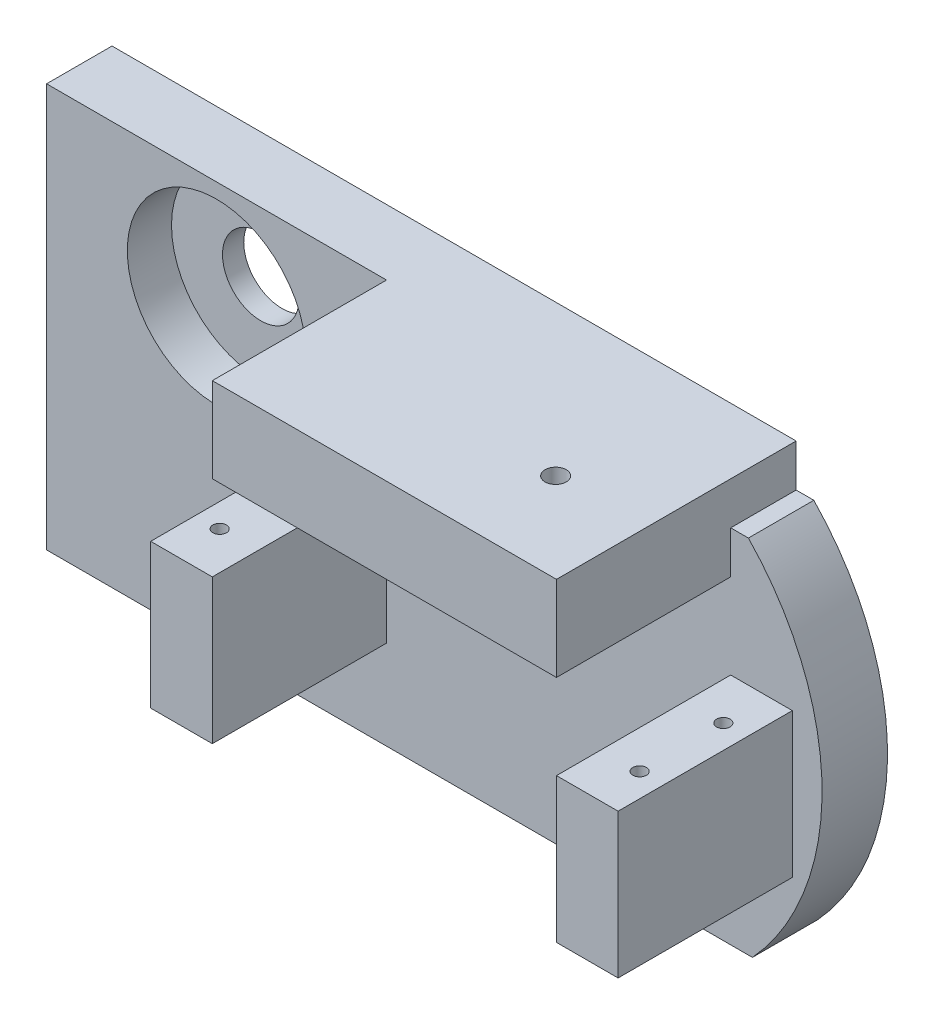
from build123d import *

# Parameters (mm, degrees)
ESQUISSE1_W              = 55
ESQUISSE1_H              = 43
BOSS_EXTRU_1_DEPTH       = 27
ESQUISSE2_W              = 40.5
ESQUISSE2_H              = 21.676575317
ENL_V_MAT_EXTRU_1_DEPTH  = 38
ESQUISSE3_R              = 0.7
ENL_V_MAT_EXTRU_2_DEPTH  = 43
ESQUISSE4_W              = 55
ESQUISSE4_H              = 20.5
ENL_V_MAT_EXTRU_3_DEPTH  = 11
ENL_V_MAT_EXTRU_6_REACH  = 66.933
ESQUISSE5_W              = 20.5
ESQUISSE5_H              = 10
ESQUISSE6_W              = 7.25
ESQUISSE6_H              = 20.5
ENL_V_MAT_EXTRU_7_DEPTH  = 5
ESQUISSE7_R              = 31
BOSS_EXTRU_2_DEPTH       = 6.5
ESQUISSE8_R              = 41
ESQUISSE8_R_2            = 31
ENL_V_MAT_EXTRU_8_DEPTH  = 6.5
TROU_TARAUD_M2X0_41_D    = 1.6
ESQUISSE10_R             = 10.5
ENL_V_MAT_EXTRU_9_DEPTH  = 4.5
ESQUISSE11_R             = 4.5
ENL_V_MAT_EXTRU_10_DEPTH = 2
ESQUISSE12_R             = 9.25
ESQUISSE12_R_2           = 1.25
BOSS_EXTRU_3_DEPTH       = 5
ESQUISSE13_W             = 50.114904395
ESQUISSE13_H             = 12.012600019
ENL_V_MAT_EXTRU_11_DEPTH = 6.5
BOSS_EXTRU_4_START       = 1.2
BOSS_EXTRU_4_DEPTH       = 1.2
ESQUISSE15_W             = 53.005482756
ESQUISSE15_H             = 10
ENL_V_MAT_EXTRU_12_DEPTH = 7.7
ESQUISSE16_R             = 4.5
ENL_V_MAT_EXTRU_13_DEPTH = 1.2
BOSS_EXTRU_5_START       = -28.2
ESQUISSE17_W             = 40.5
ESQUISSE17_H             = 5
BOSS_EXTRU_5_DEPTH       = 28.2
ESQUISSE18_R             = 1
ENL_V_MAT_EXTRU_14_DEPTH = 10
TROU_TARAUD_M3X0_51_D    = 2.5
ESQUISSE22_R             = 4.5
BOSS_EXTRU_6_DEPTH       = 7.7
ESQUISSE23_R             = 10.5
ENL_V_MAT_EXTRU_15_DEPTH = 5.2
ESQUISSE24_R             = 12.885190895
BOSS_EXTRU_7_DEPTH       = 7.7


with BuildPart() as part:
    # Esquisse1 → Boss.-Extru.1 (new body)
    with BuildSketch(Plane.XY):
        Rectangle(ESQUISSE1_W, ESQUISSE1_H)
    extrude(amount=BOSS_EXTRU_1_DEPTH)

    # Esquisse2 → Enlèv. mat.-Extru.1 (cut)
    with BuildSketch(Plane.XZ.offset(21.5)):
        with Locations((0, 17.338287659)):
            Rectangle(ESQUISSE2_W, ESQUISSE2_H)
    extrude(amount=-ENL_V_MAT_EXTRU_1_DEPTH, mode=Mode.SUBTRACT)

    # Esquisse3 → Enlèv. mat.-Extru.2 (cut)
    with BuildSketch(Plane.XZ.offset(21.5)):
        with Locations(Location((-24.71, 21.675, 0), (0, 0, 270))):
            Circle(ESQUISSE3_R)
        with Locations(Location((-24.71, 11.825, 0), (0, 0, 270))):
            Circle(ESQUISSE3_R)
        with Locations(Location((24.71, 11.825, 0), (0, 0, 270))):
            Circle(ESQUISSE3_R)
        with Locations(Location((24.71, 21.675, 0), (0, 0, 270))):
            Circle(ESQUISSE3_R)
    extrude(amount=-ENL_V_MAT_EXTRU_2_DEPTH, mode=Mode.SUBTRACT)

    # Esquisse4 → Enlèv. mat.-Extru.3 (cut)
    with BuildSketch(Plane.XZ.offset(21.5)):
        with Locations((0, 16.75)):
            Rectangle(ESQUISSE4_W, ESQUISSE4_H)
    extrude(amount=-ENL_V_MAT_EXTRU_3_DEPTH, mode=Mode.SUBTRACT)

    # Enlèv. mat.-Extru.6: up to this face of the body (flat: up to its plane)
    enl_v_mat_extru_6_end = Plane(part.part.faces().sort_by_distance((27.5, 3.85676109, 12.716595404))[0])
    # Esquisse5 → Enlèv. mat.-Extru.6 (cut, up to the picked face)
    with BuildSketch(Plane.ZY.offset(27.5), mode=Mode.PRIVATE) as enl_v_mat_extru_6_sk1:
        with Locations((16.75, 11.5)):
            Rectangle(ESQUISSE5_W, ESQUISSE5_H)
    enl_v_mat_extru_6_tool1 = split(extrude(enl_v_mat_extru_6_sk1.sketch, amount=-ENL_V_MAT_EXTRU_6_REACH, mode=Mode.PRIVATE), bisect_by=enl_v_mat_extru_6_end, keep=Keep.BOTH, mode=Mode.PRIVATE)
    add(enl_v_mat_extru_6_tool1.solids().sort_by(Axis((-27.5, 11.5, 16.75), (1, 0, 0)))[0], mode=Mode.SUBTRACT)

    # Esquisse6 → Enlèv. mat.-Extru.7 (cut)
    with BuildSketch(Plane.XZ.offset(-16.5)):
        with Locations((-23.875, 16.75)):
            Rectangle(ESQUISSE6_W, ESQUISSE6_H)
        with Locations((23.875, 16.75)):
            Rectangle(ESQUISSE6_W, ESQUISSE6_H)
    extrude(amount=-ENL_V_MAT_EXTRU_7_DEPTH, mode=Mode.SUBTRACT)

    # Esquisse7 → Boss.-Extru.2 (add)
    with BuildSketch(Plane(origin=(0, 0, 0), x_dir=(-1, 0, 0), z_dir=(0, 0, -1))):
        Circle(ESQUISSE7_R)
    extrude(amount=-BOSS_EXTRU_2_DEPTH)

    # Esquisse8 → Enlèv. mat.-Extru.8 (cut)
    with BuildSketch(Plane(origin=(0, 0, 0), x_dir=(-1, 0, 0), z_dir=(0, 0, -1))):
        Circle(ESQUISSE8_R)
        Circle(ESQUISSE8_R_2, mode=Mode.SUBTRACT)
    extrude(amount=-ENL_V_MAT_EXTRU_8_DEPTH, mode=Mode.SUBTRACT)

    # Trou taraudé M2x0.41 (through all)
    with Locations(Plane(origin=(-24.71, -10.5, 21.675), x_dir=(0, 0, -1), z_dir=(0, -1, 0))):
        with Locations((0, 0), (9.85, 0), (0, 49.42), (9.85, 49.42)):
            Hole(TROU_TARAUD_M2X0_41_D / 2)

    # Esquisse10 → Enlèv. mat.-Extru.9 (cut)
    with BuildSketch(Plane.XY.offset(6.5)):
        Circle(ESQUISSE10_R)
    extrude(amount=-ENL_V_MAT_EXTRU_9_DEPTH, mode=Mode.SUBTRACT)

    # Esquisse11 → Enlèv. mat.-Extru.10 (cut)
    with BuildSketch(Plane.XY.offset(2)):
        Circle(ESQUISSE11_R)
    extrude(amount=-ENL_V_MAT_EXTRU_10_DEPTH, mode=Mode.SUBTRACT)

    # Esquisse12 → Boss.-Extru.3 (add)
    with BuildSketch(Plane(origin=(0, 21.5, 0), x_dir=(1, 0, 0), z_dir=(0, 1, 0))):
        with Locations(Location((0, -15.876822983, 0), (0, 0, 90))):
            Circle(ESQUISSE12_R)
        with Locations(Location((0, -15.876822983, 0), (0, 0, 270))):
            Circle(ESQUISSE12_R_2, mode=Mode.SUBTRACT)
    extrude(amount=BOSS_EXTRU_3_DEPTH)

    # Esquisse13 → Enlèv. mat.-Extru.11 (cut)
    with BuildSketch(Plane.XY.offset(6.5)):
        with Locations((-0.983340997, 27.50630001)):
            Rectangle(ESQUISSE13_W, ESQUISSE13_H)
    extrude(amount=-ENL_V_MAT_EXTRU_11_DEPTH, mode=Mode.SUBTRACT)

    # Esquisse14 → Boss.-Extru.4 (add)
    with BuildSketch(Plane(origin=(0, 0, 0), x_dir=(-1, 0, 0), z_dir=(0, 0, -1)).offset(BOSS_EXTRU_4_START)):
        with BuildLine():
            Line((-22.332711434, 21.5), (22.332711434, 21.5))
            ThreePointArc((22.332711434, 21.5), (0, -31), (-22.332711434, 21.5))
        make_face()
    extrude(amount=-BOSS_EXTRU_4_DEPTH)

    # Esquisse15 → Enlèv. mat.-Extru.12 (cut)
    with BuildSketch(Plane.XY.offset(6.5)):
        with Locations((0, -26)):
            Rectangle(ESQUISSE15_W, ESQUISSE15_H)
    extrude(amount=-ENL_V_MAT_EXTRU_12_DEPTH, mode=Mode.SUBTRACT)

    # Esquisse16 → Enlèv. mat.-Extru.13 (cut)
    with BuildSketch(Plane.XY):
        Circle(ESQUISSE16_R)
    extrude(amount=-ENL_V_MAT_EXTRU_13_DEPTH, mode=Mode.SUBTRACT)

    # Esquisse17 → Boss.-Extru.5 (add)
    with BuildSketch(Plane.XY.offset(27).offset(BOSS_EXTRU_5_START)):
        with Locations((0, 24)):
            Rectangle(ESQUISSE17_W, ESQUISSE17_H)
    extrude(amount=BOSS_EXTRU_5_DEPTH)

    # Esquisse18 → Enlèv. mat.-Extru.14 (cut)
    with BuildSketch(Plane(origin=(0, 26.5, 0), x_dir=(1, 0, 0), z_dir=(0, 1, 0))):
        with Locations(Location((9.65, -16.5, 0), (0, 0, 270))):
            Circle(ESQUISSE18_R)
    extrude(amount=-ENL_V_MAT_EXTRU_14_DEPTH, mode=Mode.SUBTRACT)

    # Trou taraudé M3x0.51 (through all)
    with Locations(Plane(origin=(9.65, 26.5, 16.5), x_dir=(0, 0, 1), z_dir=(0, 1, 0))):
        with Locations((0, 0)):
            Hole(TROU_TARAUD_M3X0_51_D / 2)

    # Esquisse22 → Boss.-Extru.6 (add)
    with BuildSketch(Plane(origin=(0, 0, -1.2), x_dir=(-1, 0, 0), z_dir=(0, 0, -1))):
        Polygon((20.25, 26.5), (60.25, 26.5), (60.25, 2), (60.25, -21), (20.25, -21), (20.25, 2), align=None)
        with Locations((40.25, 14.25)):
            Circle(ESQUISSE22_R, mode=Mode.SUBTRACT)
    extrude(amount=-BOSS_EXTRU_6_DEPTH)

    # Esquisse23 → Enlèv. mat.-Extru.15 (cut)
    with BuildSketch(Plane.XY.offset(6.5)):
        with Locations((-40.25, 14.25)):
            Circle(ESQUISSE23_R)
    extrude(amount=-ENL_V_MAT_EXTRU_15_DEPTH, mode=Mode.SUBTRACT)

    # Esquisse24 → Boss.-Extru.7 (add)
    with BuildSketch(Plane(origin=(0, 0, -1.2), x_dir=(-1, 0, 0), z_dir=(0, 0, -1))):
        Circle(ESQUISSE24_R)
    extrude(amount=-BOSS_EXTRU_7_DEPTH)


solid = part.part
